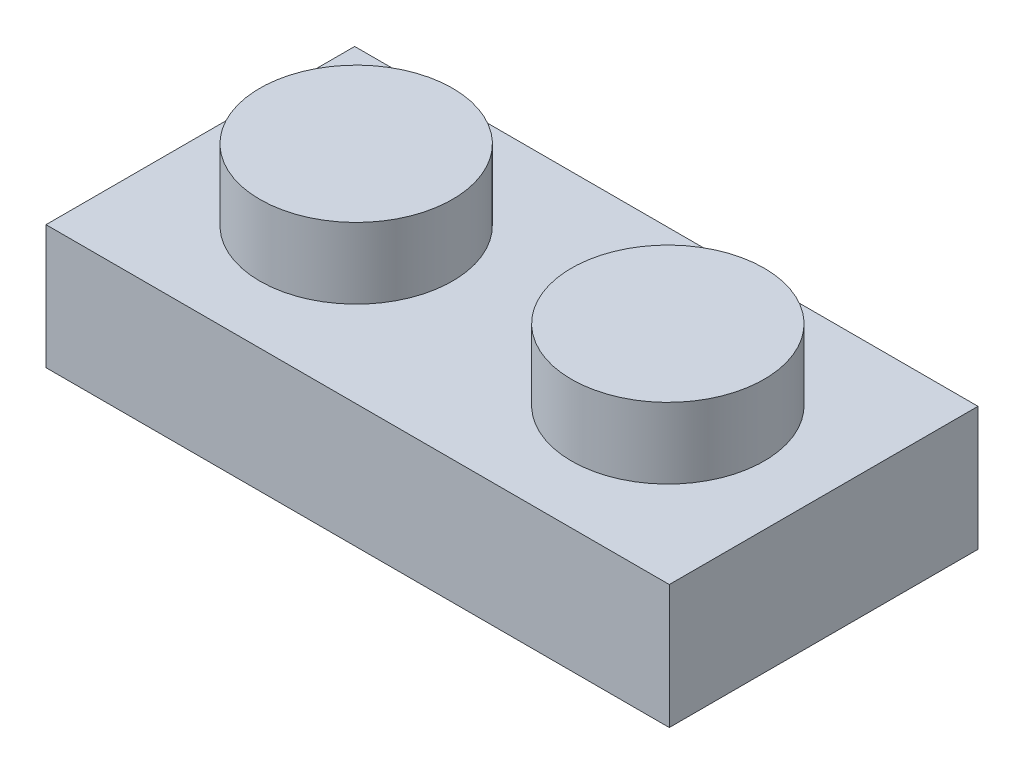
from build123d import *

# Parameters (mm, degrees)
SKETCH1_W           = 15.85
SKETCH1_H           = 7.85
BOSS_EXTRUDE1_DEPTH = 3.15
SKETCH2_R           = 2.45
BOSS_EXTRUDE2_DEPTH = 1.8
SHELL1_T            = -1.5
SKETCH3_R           = 1.5
SKETCH3_R_2         = 0.7
BOSS_EXTRUDE3_DEPTH = 1.45


with BuildPart() as part:
    # Sketch1 → Boss-Extrude1 (new body)
    with BuildSketch(Plane(origin=(0, 0, 0), x_dir=(1, 0, 0), z_dir=(0, 1, 0))):
        Rectangle(SKETCH1_W, SKETCH1_H)
    extrude(amount=-BOSS_EXTRUDE1_DEPTH)

    # Sketch2 → Boss-Extrude2 (add)
    with BuildSketch(Plane(origin=(0, 0, 0), x_dir=(1, 0, 0), z_dir=(0, 1, 0))):
        with Locations(Location((-3.9625, 0, 0), (0, 0, 270))):
            Circle(SKETCH2_R)
        with Locations(Location((3.9625, 0, 0), (0, 0, 270))):
            Circle(SKETCH2_R)
    extrude(amount=BOSS_EXTRUDE2_DEPTH)

    # Shell1
    shell1_openings = [part.faces().sort_by_distance(p)[0] for p in [
        (0, -3.15, 0),
    ]]
    offset(amount=SHELL1_T, openings=shell1_openings, kind=Kind.INTERSECTION)

    # Sketch3 → Boss-Extrude3 (add)
    with BuildSketch(Plane.XZ.offset(1.5)):
        with Locations(Location((0, 0, 0), (0, 0, 90))):
            Circle(SKETCH3_R)
        with Locations(Location((0, 0, 0), (0, 0, 90))):
            Circle(SKETCH3_R_2, mode=Mode.SUBTRACT)
    extrude(amount=BOSS_EXTRUDE3_DEPTH)


solid = part.part
